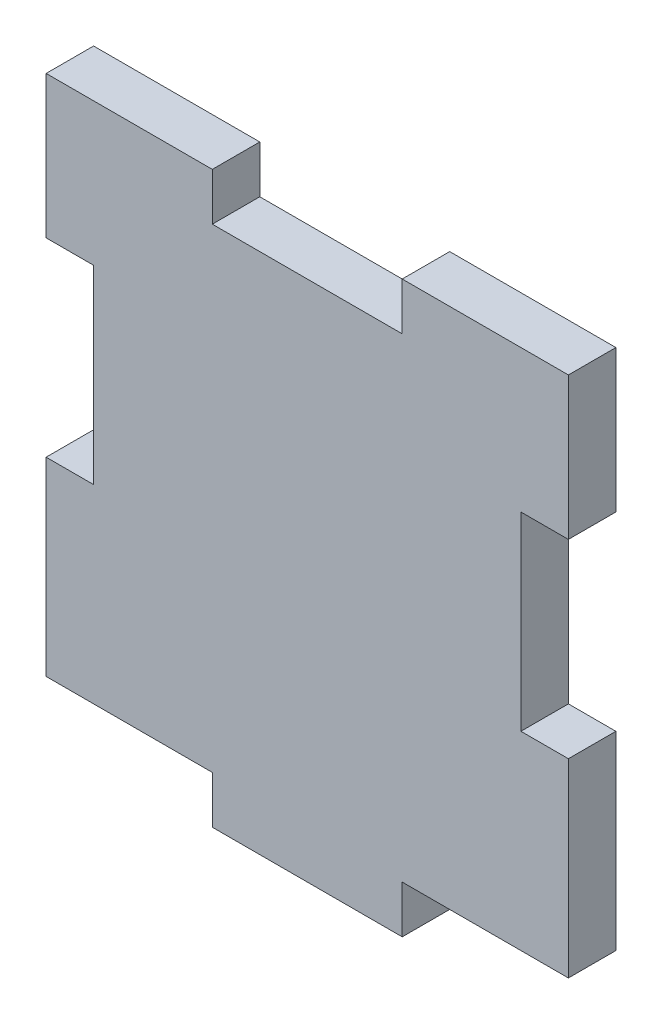
from build123d import *

# Parameters (mm, degrees)
EXTRUDE1_DEPTH = 6.35


with BuildPart() as part:
    # Sketch1 → Extrude1 (new body)
    with BuildSketch(Plane.XY):
        Polygon((0, 6.35), (22.225, 6.35), (22.225, 0), (47.625, 0), (47.625, 6.35), (69.85, 6.35), (69.85, 31.75), (63.5, 31.75), (63.5, 57.15), (69.85, 57.15), (69.85, 76.2), (47.625, 76.2), (47.625, 69.85), (22.225, 69.85), (22.225, 76.2), (0, 76.2), (0, 57.15), (6.35, 57.15), (6.35, 31.75), (0, 31.75), align=None)
    extrude(amount=EXTRUDE1_DEPTH)


solid = part.part
